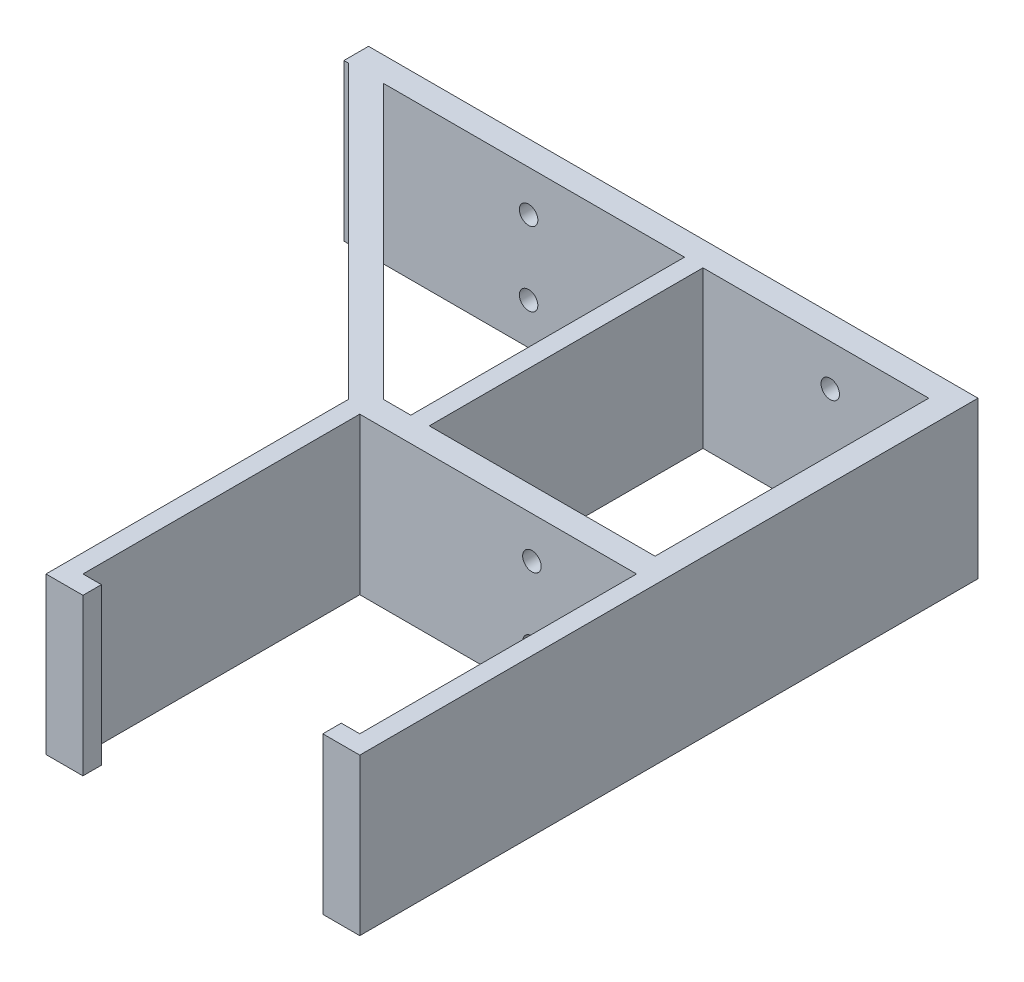
from build123d import *

# Parameters (mm, degrees)
SKETCH1_W           = 3
SKETCH1_H           = 44.45
BOSS_EXTRUDE1_DEPTH = 25.4
SKETCH10_R          = 1.5
CUT_EXTRUDE1_DEPTH  = 125.927823604


with BuildPart() as part:
    # Sketch1 → Boss-Extrude1 (new body)
    with BuildSketch(Plane(origin=(0, 0, 0), x_dir=(1, 0, 0), z_dir=(0, 1, 0))):
        with Locations((-13.038815819, 45.598435945)):
            Rectangle(SKETCH1_W, SKETCH1_H)
        Polygon((25.128862589, 23.373435945), (29.128862589, 23.373435945), (29.128862589, 71.823435945), (25.128862589, 71.823435945), (25.128862589, 67.823435945), align=None)
        Polygon((-67.439681, 71.812406658), (-63.450710286, 67.823435945), (-14.538815819, 67.823435945), (-11.538815819, 67.823435945), (25.128862589, 67.823435945), (25.128862589, 71.823435945), (-69.857244767, 71.823435945), (-69.857244767, 69.394842891), align=None)
        Polygon((-69.857244767, 68.573116176), (-69.107564536, 67.823435945), (-63.450710286, 67.823435945), (-67.439681, 71.812406658), (-69.857244767, 69.394842891), align=None)
        Polygon((-69.857244767, 67.823435945), (-69.107564536, 67.823435945), (-69.857244767, 68.573116176), align=None)
        Polygon((-69.107564536, 67.823435945), (-21.829137411, 20.54500882), (-21.829137411, 23.373435945), (-19.000710286, 23.373435945), (-63.450710286, 67.823435945), align=None)
        Polygon((-21.829137411, 20.54500882), (-21.829137411, -28.584564055), (-15.829137411, -28.584564055), (-15.829137411, -25.584564055), (-18.829137411, -25.584564055), (-18.829137411, 19.373435945), (26.128862589, 19.373435945), (26.128862589, -25.584564055), (23.128862589, -25.584564055), (23.128862589, -28.584564055), (29.128862589, -28.584564055), (29.128862589, 23.373435945), (25.128862589, 23.373435945), (-11.538815819, 23.373435945), (-14.538815819, 23.373435945), (-19.000710286, 23.373435945), align=None)
        Polygon((-21.829137411, 23.373435945), (-21.829137411, 20.54500882), (-19.000710286, 23.373435945), align=None)
    extrude(amount=BOSS_EXTRUDE1_DEPTH)

    # Sketch10 → Cut-Extrude1 (cut, through all)
    with BuildSketch(Plane(origin=(0, 0, -71.823435945), x_dir=(-1, 0, 0), z_dir=(0, 0, -1))):
        with Locations((39.857244767, 6.7)):
            Circle(SKETCH10_R)
        with Locations((39.857244767, 18.7)):
            Circle(SKETCH10_R)
        with Locations((-9.128862589, 6.7)):
            Circle(SKETCH10_R)
        with Locations((-9.128862589, 18.7)):
            Circle(SKETCH10_R)
    extrude(amount=-CUT_EXTRUDE1_DEPTH, mode=Mode.SUBTRACT)


solid = part.part
